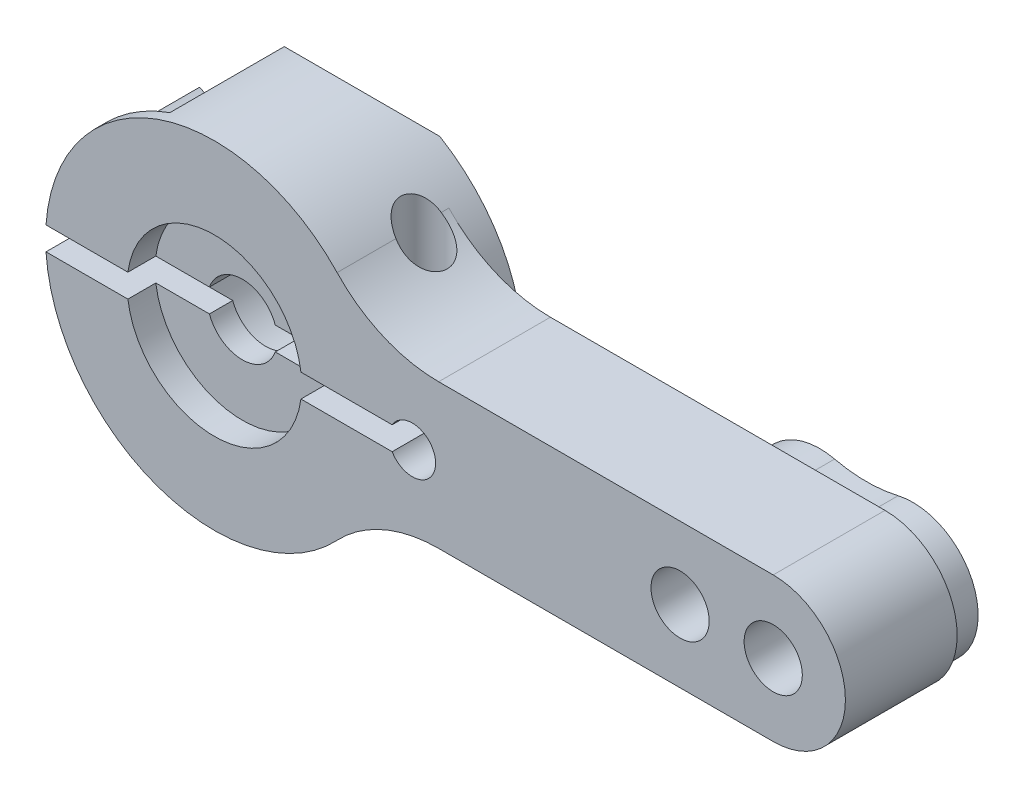
from build123d import *

# Parameters (mm, degrees)
SKETCH_1_R               = 1.25
EXTRUDE_1_DEPTH          = 6
CUT_EXTRUDE_1_DEPTH      = 1.2
SKETCH_1_4_R             = 2.75
CUT_EXTRUDE_2_DEPTH      = 3.8
CUT_EXTRUDE_START        = 6
SKETCH_1_5_R             = 3.75
CUT_EXTRUDE_3_DEPTH      = 1.2
FILLET_1_R               = 6
SKETCH_2_R               = 3
CUT_EXTRUDE_4_DEPTH      = 5.5
CUT_EXTRUDE_5_DEPTH      = 29.687497277
CUT_EXTRUDE_5_DEPTH_BACK = 29.687497277
SKETCH_3_R               = 1
CUT_EXTRUDE_6_DEPTH      = 29.687497323
CUT_EXTRUDE_6_DEPTH_BACK = 29.687497323


with BuildPart() as part:
    # Эскиз1 → Бобышка-Вытянуть1 (new body)
    # profile 1 of 8: a face of its own
    with BuildSketch(Plane.XY):
        with BuildLine():
            ThreePointArc((24, -3.1), (27.1, 0), (24, 3.1))
            Line((24, 3.1), (6.553815682, 3.1))
            ThreePointArc((6.553815682, 3.1), (7.014789099, 1.831729757), (7.232738071, 0.5))
            Line((7.232738071, 0.5), (7.633974596, 0.5))
            ThreePointArc((7.633974596, 0.5), (8.758819045, 0.965925826), (9.5, 0))
            ThreePointArc((9.5, 0), (8.758819045, -0.965925826), (7.633974596, -0.5))
            Line((7.633974596, -0.5), (7.232738071, -0.5))
            ThreePointArc((7.232738071, -0.5), (7.014789099, -1.831729757), (6.553815682, -3.1))
            Line((6.553815682, -3.1), (24, -3.1))
        make_face()
        with BuildLine():
            ThreePointArc((23.363636364, 2.726727218), (26.8, 0), (23.363636364, -2.726727218))
            ThreePointArc((23.363636364, -2.726727218), (22, -2.569714114), (20.636363636, -2.726727218))
            ThreePointArc((20.636363636, -2.726727218), (17.2, 0), (20.636363636, 2.726727218))
            ThreePointArc((20.636363636, 2.726727218), (22, 2.569714114), (23.363636364, 2.726727218))
        make_face(mode=Mode.SUBTRACT)
    # profile 2 of 8: a face of its own
    with BuildSketch(Plane.XY):
        with BuildLine():
            ThreePointArc((20.636363636, 2.726727218), (22, 2.569714114), (23.363636364, 2.726727218))
            ThreePointArc((23.363636364, 2.726727218), (26.8, 0), (23.363636364, -2.726727218))
            ThreePointArc((23.363636364, -2.726727218), (22, -2.569714114), (20.636363636, -2.726727218))
            ThreePointArc((20.636363636, -2.726727218), (17.2, 0), (20.636363636, 2.726727218))
        make_face()
        with Locations((20, 0)):
            Circle(SKETCH_1_R, mode=Mode.SUBTRACT)
        with Locations((24, 0)):
            Circle(SKETCH_1_R, mode=Mode.SUBTRACT)
    # profile 3 of 8: a face of its own
    with BuildSketch(Plane.XY):
        with BuildLine():
            ThreePointArc((7.232738071, 0.5), (7.014789099, 1.831729757), (6.553815682, 3.1))
            ThreePointArc((6.553815682, 3.1), (-1.343589931, 7.124413386), (-7.232738071, 0.5))
            Line((-7.232738071, 0.5), (-3.716517187, 0.5))
            ThreePointArc((-3.716517187, 0.5), (0, 3.75), (3.716517187, 0.5))
            Line((3.716517187, 0.5), (7.232738071, 0.5))
        make_face()
    # profile 4 of 8: a face of its own
    with BuildSketch(Plane.XY):
        with BuildLine():
            ThreePointArc((3.716517187, 0.5), (0, 3.75), (-3.716517187, 0.5))
            Line((-3.716517187, 0.5), (-2.704163457, 0.5))
            ThreePointArc((-2.704163457, 0.5), (0, 2.75), (2.704163457, 0.5))
            Line((2.704163457, 0.5), (3.716517187, 0.5))
        make_face()
    # profile 5 of 8: a face of its own
    with BuildSketch(Plane.XY):
        with BuildLine():
            ThreePointArc((2.704163457, 0.5), (0, 2.75), (-2.704163457, 0.5))
            Line((-2.704163457, 0.5), (-1.414213562, 0.5))
            ThreePointArc((-1.414213562, 0.5), (0, 1.5), (1.414213562, 0.5))
            Line((1.414213562, 0.5), (2.704163457, 0.5))
        make_face()
    # profile 6 of 8: a face of its own
    with BuildSketch(Plane.XY):
        with BuildLine():
            ThreePointArc((-7.232738071, -0.5), (-1.343589931, -7.124413386), (6.553815682, -3.1))
            ThreePointArc((6.553815682, -3.1), (7.014789099, -1.831729757), (7.232738071, -0.5))
            Line((7.232738071, -0.5), (3.716517187, -0.5))
            ThreePointArc((3.716517187, -0.5), (0, -3.75), (-3.716517187, -0.5))
            Line((-3.716517187, -0.5), (-7.232738071, -0.5))
        make_face()
    # profile 7 of 8: a face of its own
    with BuildSketch(Plane.XY):
        with BuildLine():
            Line((-2.704163457, -0.5), (-3.716517187, -0.5))
            ThreePointArc((-3.716517187, -0.5), (0, -3.75), (3.716517187, -0.5))
            Line((3.716517187, -0.5), (2.704163457, -0.5))
            ThreePointArc((2.704163457, -0.5), (0, -2.75), (-2.704163457, -0.5))
        make_face()
    # profile 8 of 8: a face of its own
    with BuildSketch(Plane.XY):
        with BuildLine():
            Line((-1.414213562, -0.5), (-2.704163457, -0.5))
            ThreePointArc((-2.704163457, -0.5), (0, -2.75), (2.704163457, -0.5))
            Line((2.704163457, -0.5), (1.414213562, -0.5))
            ThreePointArc((1.414213562, -0.5), (0, -1.5), (-1.414213562, -0.5))
        make_face()
    extrude(amount=EXTRUDE_1_DEPTH)

    # Эскиз1<3> → Вырез-Вытянуть1 (cut)
    with BuildSketch(Plane.XY):
        with BuildLine():
            ThreePointArc((24, -3.1), (27.1, 0), (24, 3.1))
            Line((24, 3.1), (6.553815682, 3.1))
            ThreePointArc((6.553815682, 3.1), (7.014789099, 1.831729757), (7.232738071, 0.5))
            Line((7.232738071, 0.5), (7.633974596, 0.5))
            ThreePointArc((7.633974596, 0.5), (8.758819045, 0.965925826), (9.5, 0))
            ThreePointArc((9.5, 0), (8.758819045, -0.965925826), (7.633974596, -0.5))
            Line((7.633974596, -0.5), (7.232738071, -0.5))
            ThreePointArc((7.232738071, -0.5), (7.014789099, -1.831729757), (6.553815682, -3.1))
            Line((6.553815682, -3.1), (24, -3.1))
        make_face()
        with BuildLine():
            ThreePointArc((23.363636364, 2.726727218), (26.8, 0), (23.363636364, -2.726727218))
            ThreePointArc((23.363636364, -2.726727218), (22, -2.569714114), (20.636363636, -2.726727218))
            ThreePointArc((20.636363636, -2.726727218), (17.2, 0), (20.636363636, 2.726727218))
            ThreePointArc((20.636363636, 2.726727218), (22, 2.569714114), (23.363636364, 2.726727218))
        make_face(mode=Mode.SUBTRACT)
    extrude(amount=CUT_EXTRUDE_1_DEPTH, mode=Mode.SUBTRACT)

    # Эскиз1<4> → Вырез-Вытянуть2 (cut)
    with BuildSketch(Plane.XY):
        Circle(SKETCH_1_4_R)
    extrude(amount=CUT_EXTRUDE_2_DEPTH, mode=Mode.SUBTRACT)

    # Эскиз1<5> → Вырез-Вытянуть3 (cut)
    with BuildSketch(Plane.XY.offset(CUT_EXTRUDE_START)):
        Circle(SKETCH_1_5_R)
    extrude(amount=-CUT_EXTRUDE_3_DEPTH, mode=Mode.SUBTRACT)

    # Скругление1
    fillet_1_edges = [part.edges().sort_by_distance(p)[0] for p in [
        (6.553815682, 3.1, 3.6),
        (6.553815682, -3.1, 3.6),
    ]]
    fillet(fillet_1_edges, radius=FILLET_1_R)

    # Эскиз2 → Вырез-Вытянуть4 (cut)
    with BuildSketch(Plane.XY):
        with Locations((5.099019514, -5.5)):
            Circle(SKETCH_2_R)
        with Locations((-5.099019514, 5.5)):
            Circle(SKETCH_2_R)
    extrude(amount=CUT_EXTRUDE_4_DEPTH, mode=Mode.SUBTRACT)

    # Эскиз3 → Вырез-Вытянуть5 (cut, two sides: drawn at the far end of the back side and taken through both)
    with BuildSketch(Plane(origin=(0, 0, 0), x_dir=(1, 0, 0), z_dir=(0, 1, 0)).offset(-CUT_EXTRUDE_5_DEPTH_BACK)):
        with Locations(Location((5.5, -2.5, 0), (0, 0, 270))):
            Circle(SKETCH_3_R)
        with Locations(Location((-5.5, -2.5, 0), (0, 0, 270))):
            Circle(SKETCH_3_R)
    extrude(amount=CUT_EXTRUDE_5_DEPTH + CUT_EXTRUDE_5_DEPTH_BACK, mode=Mode.SUBTRACT)

    # Эскиз4 → Вырез-Вытянуть6 (cut, two sides: drawn at the far end of the back side and taken through both)
    with BuildSketch(Plane(origin=(0, 0, 0), x_dir=(0, 0, -1), z_dir=(1, 0, 0)).offset(-CUT_EXTRUDE_6_DEPTH_BACK)):
        Polygon((0, -6.25), (-1, -7.25), (0, -7.25), align=None)
        Polygon((0, 7.25), (0, 6.25), (-1, 7.25), align=None)
    extrude(amount=CUT_EXTRUDE_6_DEPTH + CUT_EXTRUDE_6_DEPTH_BACK, mode=Mode.SUBTRACT)


solid = part.part
